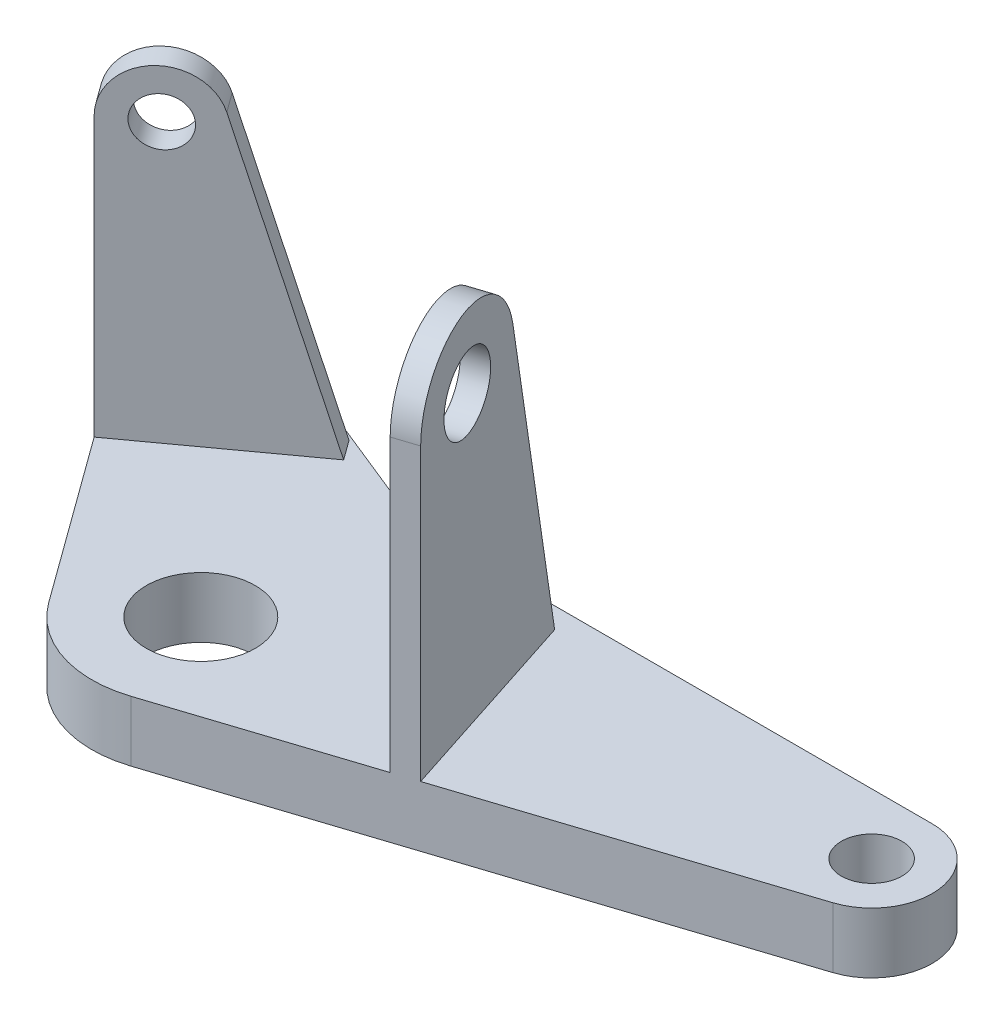
from build123d import *

# Parameters (mm, degrees)
SKETCH1_R           = 9
SKETCH1_R_2         = 3
SKETCH1_R_3         = 5
BOSS_EXTRUDE1_DEPTH = 10
SKETCH_L_R          = 6
BOSS_EXTRUDE2_DEPTH = 4
SKETCH6_R           = 4
BOSS_EXTRUDE3_DEPTH = 4


with BuildPart() as part:
    # Sketch1 → Boss-Extrude1 (new body)
    with BuildSketch(Plane(origin=(0, 0, 0), x_dir=(1, 0, 0), z_dir=(0, 1, 0))):
        with BuildLine():
            Line((5.562305899, -17.119017293), (93.090169944, 11.320509704))
            ThreePointArc((93.090169944, 11.320509704), (99.876883406, 22.395419517), (90, 30.831074867))
            Line((90, 30.831074867), (12.860666935, 30.831074867))
            ThreePointArc((12.860666935, 30.831074867), (4.846689129, 31.602733162), (-2.872809988, 33.889352975))
            Line((-2.872809988, 33.889352975), (-45.75236044, 51.21381591))
            ThreePointArc((-45.75236044, 51.21381591), (-52.728064522, 49.344681634), (-52.854101966, 42.124001268))
            Line((-52.854101966, 42.124001268), (-14.562305899, -10.580134541))
            ThreePointArc((-14.562305899, -10.580134541), (-5.562305899, -17.119017293), (5.562305899, -17.119017293))
        make_face()
        with Locations(Location((0, 0, 0), (0, 0, 270))):
            Circle(SKETCH1_R, mode=Mode.SUBTRACT)
        with Locations(Location((-48, 45.650712782, 0), (0, 0, 270))):
            Circle(SKETCH1_R_2, mode=Mode.SUBTRACT)
        with Locations(Location((90, 20.831074867, 0), (0, 0, 270))):
            Circle(SKETCH1_R_3, mode=Mode.SUBTRACT)
    extrude(amount=BOSS_EXTRUDE1_DEPTH)

    # Sketch l → Boss-Extrude2 (add)
    with BuildSketch(Plane(origin=(32.335921554, 0, -10.506577809), x_dir=(0, -1, 0), z_dir=(-0.9510565162951555, 0, 0.3090169943749418))):
        with BuildLine():
            Line((-10, 18), (-58, 18))
            ThreePointArc((-58, 18), (-69.934262744, 7.254341559), (-60.49494029, -5.737771209))
            Line((-60.49494029, -5.737771209), (-10, -16.470802099))
            Line((-10, -16.470802099), (-10, 18))
        make_face()
        with Locations(Location((-58, 6, 0), (0, 0, 90))):
            Circle(SKETCH_L_R, mode=Mode.SUBTRACT)
    extrude(amount=-BOSS_EXTRUDE2_DEPTH)

    # Sketch6 → Boss-Extrude3 (add)
    with BuildSketch(Plane(origin=(-19.984698578, 0, -27.506577809), x_dir=(0, -1, 0), z_dir=(-0.5877852522924776, 0, -0.8090169943749442))):
        with BuildLine():
            Line((-10, 18), (-56, 18))
            ThreePointArc((-56, 18), (-63.92214455, 11.113384808), (-58.205098847, 2.309906432))
            Line((-58.205098847, 2.309906432), (-10, -11.512683232))
            Line((-10, -11.512683232), (-10, 18))
        make_face()
        with Locations(Location((-56, 10, 0), (0, 0, 90))):
            Circle(SKETCH6_R, mode=Mode.SUBTRACT)
    extrude(amount=BOSS_EXTRUDE3_DEPTH)


solid = part.part
